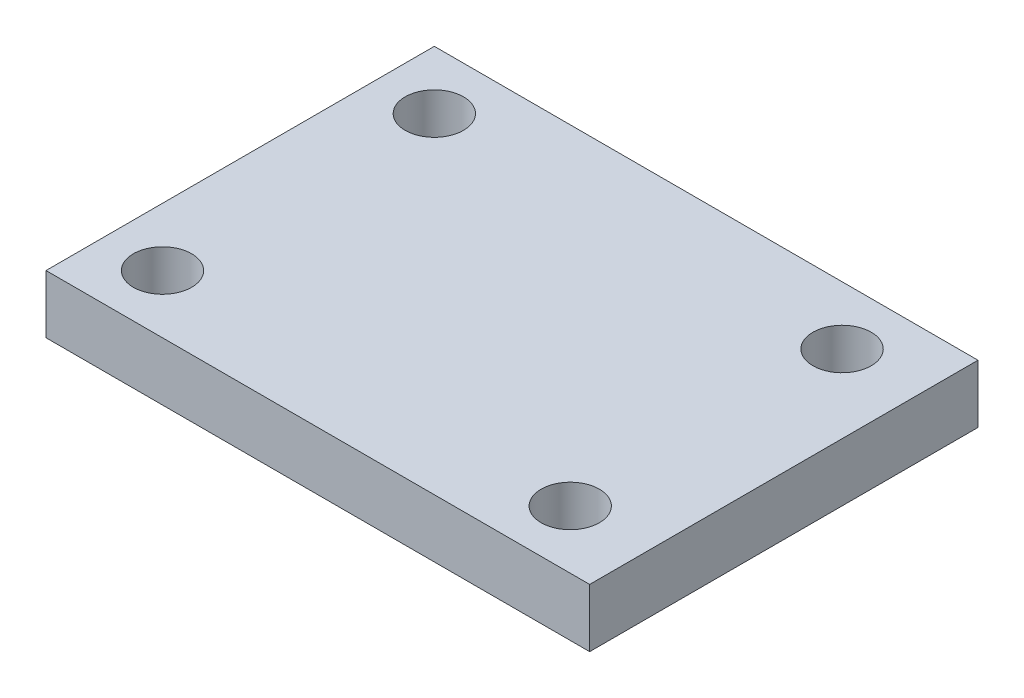
from build123d import *

# Parameters (mm, degrees)
SKETCH1_W                = 28
SKETCH1_H                = 20
BOSS_EXTRUDE1_DEPTH      = 3
F_3_0_3_DIAMETER_HOLE1_D = 3


with BuildPart() as part:
    # Sketch1 → Boss-Extrude1 (new body)
    with BuildSketch(Plane(origin=(0, 0, 0), x_dir=(1, 0, 0), z_dir=(0, 1, 0))):
        Rectangle(SKETCH1_W, SKETCH1_H)
    extrude(amount=BOSS_EXTRUDE1_DEPTH)

    # Ø3.0 (3) Diameter Hole1 (through all)
    with Locations(Plane(origin=(0, 3, 0), x_dir=(1, 0, 0), z_dir=(0, 1, 0))):
        with Locations((-11, 7), (-11, -7), (10, -7), (10, 7)):
            Hole(F_3_0_3_DIAMETER_HOLE1_D / 2)


solid = part.part
